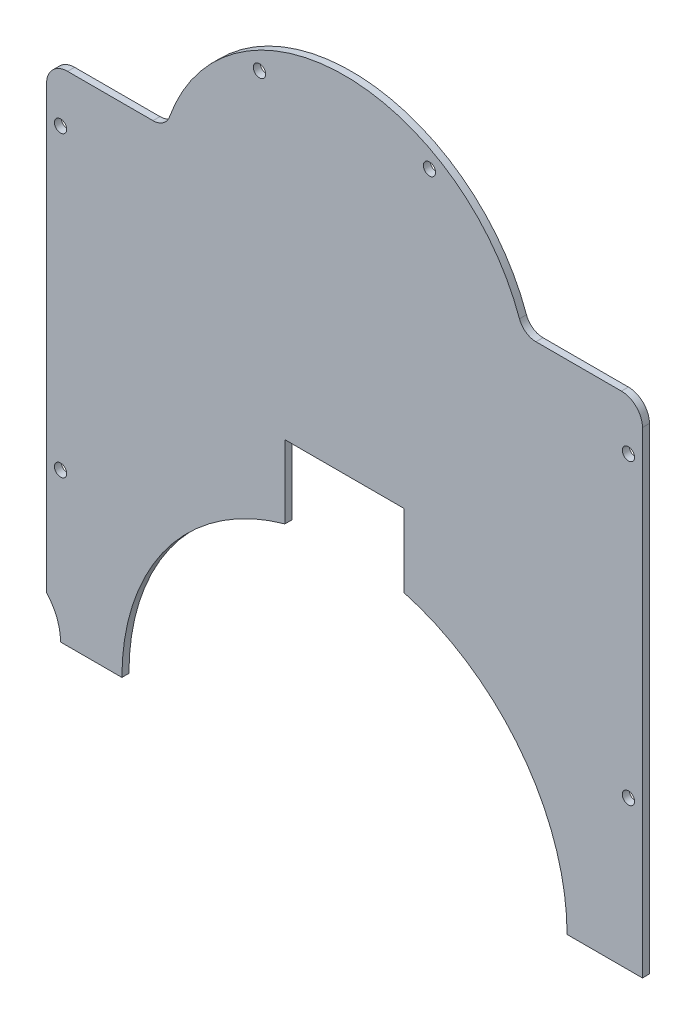
from build123d import *

# Parameters (mm, degrees)
ESQUISSE1_R      = 1.75
EXTRUSION1_DEPTH = 2


with BuildPart() as part:
    # Esquisse1 → Extrusion1 (new body)
    with BuildSketch(Plane.XY):
        with BuildLine():
            Line((79, 142), (54.623712799, 142))
            ThreePointArc((54.623712799, 142), (51.743189619, 142.913120236), (49.914772041, 145.318965517))
            ThreePointArc((49.914772041, 145.318965517), (0, 180.5), (-49.914772041, 145.318965517))
            ThreePointArc((-49.914772041, 145.318965517), (-51.743189619, 142.913120236), (-54.623712799, 142))
            Line((-54.623712799, 142), (-79, 142))
            ThreePointArc((-79, 142), (-83.242640687, 140.242640687), (-85, 136))
            Line((-85, 136), (-85, 10.198039027))
            ThreePointArc((-85, 10.198039027), (-82.035759956, 5.477225575), (-81, 0))
            Line((-81, 0), (-63.5, 0))
            ThreePointArc((-63.5, 0), (-50.555662393, 38.423625545), (-17, 61.182105227))
            Line((-17, 61.182105227), (-17, 82))
            Line((-17, 82), (17, 82))
            Line((17, 82), (17, 61.182105227))
            ThreePointArc((17, 61.182105227), (50.555662393, 38.423625545), (63.5, 0))
            Line((63.5, 0), (85, 0))
            Line((85, 0), (85, 136))
            ThreePointArc((85, 136), (83.242640687, 140.242640687), (79, 142))
        make_face()
        with Locations((-81, 42.5)):
            Circle(ESQUISSE1_R, mode=Mode.SUBTRACT)
        with Locations((-81, 127.5)):
            Circle(ESQUISSE1_R, mode=Mode.SUBTRACT)
        with Locations((-24.25, 169.502232084)):
            Circle(ESQUISSE1_R, mode=Mode.SUBTRACT)
        with Locations(Location((24.25, 169.502232084, 0), (0, 0, 180))):
            Circle(ESQUISSE1_R, mode=Mode.SUBTRACT)
        with Locations(Location((81, 127.5, 0), (0, 0, 180))):
            Circle(ESQUISSE1_R, mode=Mode.SUBTRACT)
        with Locations(Location((81, 42.5, 0), (0, 0, 180))):
            Circle(ESQUISSE1_R, mode=Mode.SUBTRACT)
    extrude(amount=EXTRUSION1_DEPTH)


solid = part.part
